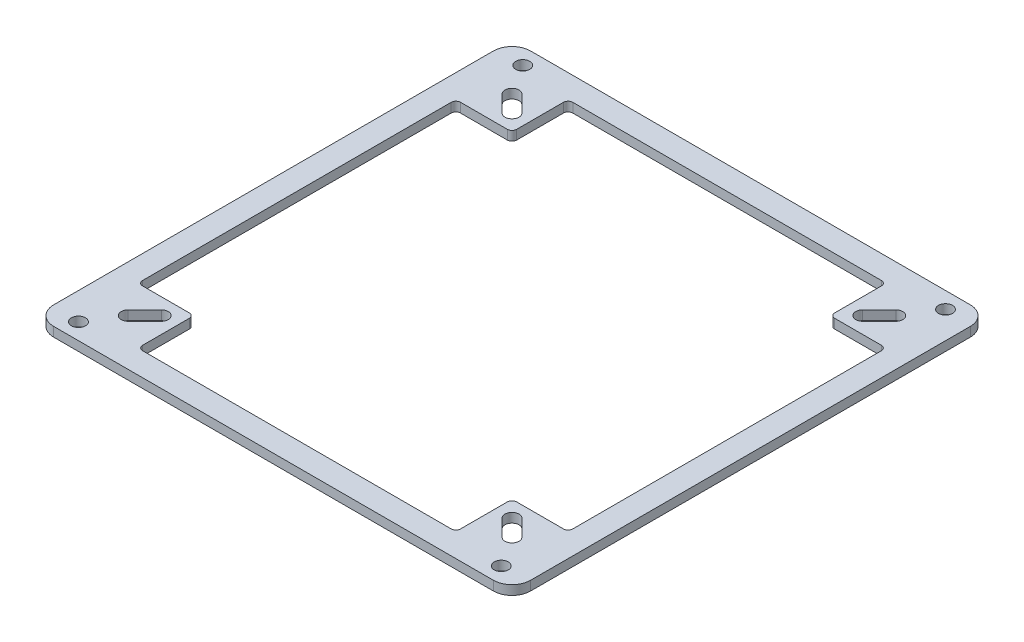
from build123d import *

# Parameters (mm, degrees)
SKETCH_1_W          = 102
SKETCH_1_H          = 102
SKETCH_1_R          = 1.5
SKETCH_1_R_2        = 1
EXTRUDE_1_DEPTH     = 2
SKETCH_2_W          = 92
SKETCH_2_H          = 68
CUT_EXTRUDE_1_DEPTH = 10
SKETCH_3_W          = 68
SKETCH_3_H          = 92
CUT_EXTRUDE_2_DEPTH = 10
FILLET_1_R          = 4
CUT_EXTRUDE_3_DEPTH = 10
FILLET_2_R          = 1


with BuildPart() as part:
    # 草图1 → 凸台-拉伸1 (new body)
    with BuildSketch(Plane(origin=(0, 0, 0), x_dir=(1, 0, 0), z_dir=(0, 1, 0))):
        with Locations((-50.486691813, 4.007835052)):
            Rectangle(SKETCH_1_W, SKETCH_1_H)
        with Locations(Location((-95.686691813, -43.492164948, 0), (0, 0, 270))):
            Circle(SKETCH_1_R, mode=Mode.SUBTRACT)
        with Locations(Location((-95.686691813, 51.507835052, 0), (0, 0, 270))):
            Circle(SKETCH_1_R, mode=Mode.SUBTRACT)
        with Locations(Location((-5.286691813, -43.492164948, 0), (0, 0, 270))):
            Circle(SKETCH_1_R, mode=Mode.SUBTRACT)
        with Locations(Location((-5.286691813, 51.507835052, 0), (0, 0, 270))):
            Circle(SKETCH_1_R, mode=Mode.SUBTRACT)
        with Locations(Location((-90.486691813, -35.992164948, 0), (0, 0, 270))):
            Circle(SKETCH_1_R_2, mode=Mode.SUBTRACT)
        with Locations(Location((-90.486691813, 44.007835052, 0), (0, 0, 270))):
            Circle(SKETCH_1_R_2, mode=Mode.SUBTRACT)
        with Locations(Location((-10.486691813, -35.992164948, 0), (0, 0, 270))):
            Circle(SKETCH_1_R_2, mode=Mode.SUBTRACT)
        with Locations(Location((-10.486691813, 44.007835052, 0), (0, 0, 270))):
            Circle(SKETCH_1_R_2, mode=Mode.SUBTRACT)
    extrude(amount=EXTRUDE_1_DEPTH)

    # 草图2 → 切除-拉伸1 (cut)
    with BuildSketch(Plane(origin=(0, 2, 0), x_dir=(1, 0, 0), z_dir=(0, 1, 0))):
        with Locations((-50.486691813, 4.007835052)):
            Rectangle(SKETCH_2_W, SKETCH_2_H)
    extrude(amount=-CUT_EXTRUDE_1_DEPTH, mode=Mode.SUBTRACT)

    # 草图3 → 切除-拉伸2 (cut)
    with BuildSketch(Plane(origin=(0, 2, 0), x_dir=(1, 0, 0), z_dir=(0, 1, 0))):
        with Locations((-50.486691813, 4.007835052)):
            Rectangle(SKETCH_3_W, SKETCH_3_H)
    extrude(amount=-CUT_EXTRUDE_2_DEPTH, mode=Mode.SUBTRACT)

    # 圆角1
    fillet_1_edges = [part.edges().sort_by_distance(p)[0] for p in [
        (0.513308187, 1, -55.007835052),
        (0.513308187, 1, 46.992164948),
        (-101.486691813, 1, 46.992164948),
        (-101.486691813, 1, -55.007835052),
    ]]
    fillet(fillet_1_edges, radius=FILLET_1_R)

    # 草图4 → 切除-拉伸3 (cut)
    with BuildSketch(Plane(origin=(0, 2, 0), x_dir=(1, 0, 0), z_dir=(0, 1, 0))):
        with BuildLine():
            Line((-89.047351985, 40.44717488), (-92.58288589, 43.982708786))
            ThreePointArc((-92.58288589, 43.982708786), (-92.58288589, 46.104029129), (-90.461565547, 46.104029129))
            Line((-90.461565547, 46.104029129), (-86.926031641, 42.568495223))
            ThreePointArc((-86.926031641, 42.568495223), (-86.926031641, 40.44717488), (-89.047351985, 40.44717488))
        make_face()
        with BuildLine():
            Line((-14.047351985, 42.568495223), (-10.511818079, 46.104029129))
            ThreePointArc((-10.511818079, 46.104029129), (-8.390497735, 46.104029129), (-8.390497735, 43.982708786))
            Line((-8.390497735, 43.982708786), (-11.926031641, 40.44717488))
            ThreePointArc((-11.926031641, 40.44717488), (-14.047351985, 40.44717488), (-14.047351985, 42.568495223))
        make_face()
        with BuildLine():
            Line((-11.926031641, -32.431504777), (-8.390497735, -35.967038683))
            ThreePointArc((-8.390497735, -35.967038683), (-8.390497735, -38.088359026), (-10.511818079, -38.088359026))
            Line((-10.511818079, -38.088359026), (-14.047351985, -34.55282512))
            ThreePointArc((-14.047351985, -34.55282512), (-14.047351985, -32.431504777), (-11.926031641, -32.431504777))
        make_face()
        with BuildLine():
            Line((-86.926031641, -34.55282512), (-90.461565547, -38.088359026))
            ThreePointArc((-90.461565547, -38.088359026), (-92.58288589, -38.088359026), (-92.58288589, -35.967038683))
            Line((-92.58288589, -35.967038683), (-89.047351985, -32.431504777))
            ThreePointArc((-89.047351985, -32.431504777), (-86.926031641, -32.431504777), (-86.926031641, -34.55282512))
        make_face()
    extrude(amount=-CUT_EXTRUDE_3_DEPTH, mode=Mode.SUBTRACT)

    # 圆角2
    fillet_2_edges = [part.edges().sort_by_distance(p)[0] for p in [
        (-96.486691813, 1, 29.992164948),
        (-96.486691813, 1, -38.007835052),
        (-4.486691813, 1, -38.007835052),
        (-4.486691813, 1, 29.992164948),
        (-16.486691813, 1, 29.992164948),
        (-84.486691813, 1, 29.992164948),
        (-84.486691813, 1, -38.007835052),
        (-16.486691813, 1, -50.007835052),
        (-16.486691813, 1, -38.007835052),
        (-84.486691813, 1, 41.992164948),
        (-84.486691813, 1, -50.007835052),
        (-16.486691813, 1, 41.992164948),
    ]]
    fillet(fillet_2_edges, radius=FILLET_2_R)


solid = part.part
